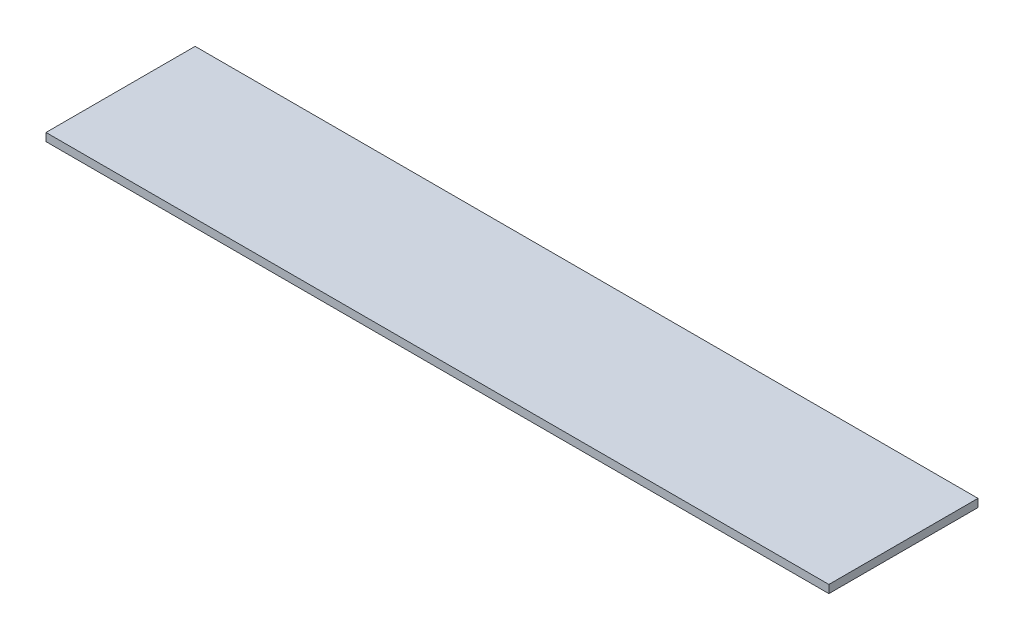
from build123d import *

# Parameters (mm, degrees)
SKETCH1_W           = 1866.9
SKETCH1_H           = 355.6
BOSS_EXTRUDE1_DEPTH = 19.05


with BuildPart() as part:
    # Sketch1 → Boss-Extrude1 (new body)
    with BuildSketch(Plane(origin=(0, 0, 0), x_dir=(1, 0, 0), z_dir=(0, 1, 0))):
        Rectangle(SKETCH1_W, SKETCH1_H)
    extrude(amount=BOSS_EXTRUDE1_DEPTH)


solid = part.part
